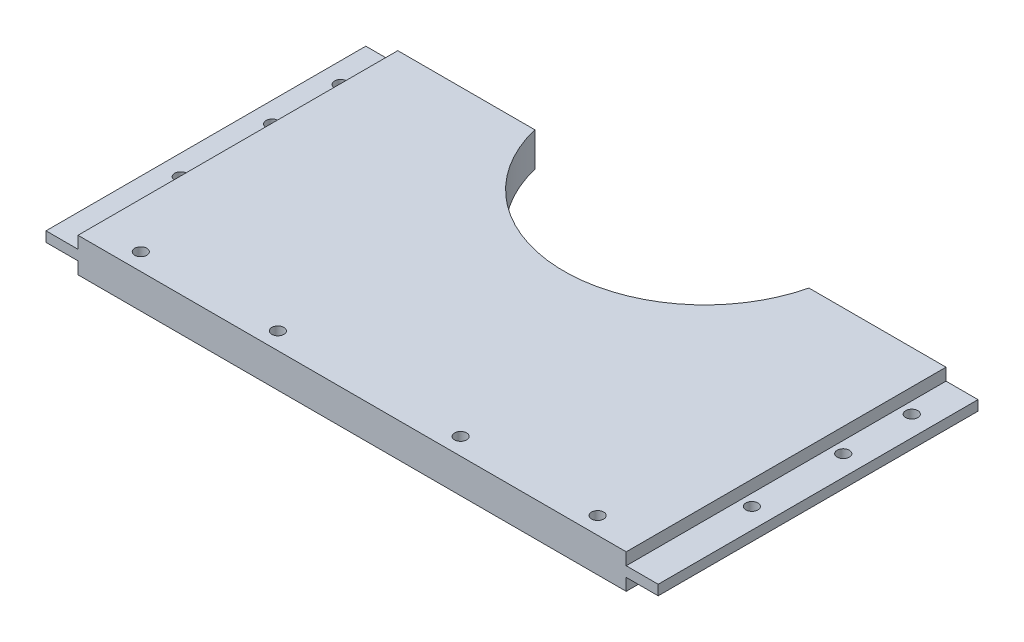
from build123d import *

# Parameters (mm, degrees)
BOSS_EXTRUDE1_DEPTH     = 9.525
SKETCH2_W               = 17.78
SKETCH2_H               = 177.8
BOSS_EXTRUDE2_DEPTH     = 2.794
F_1_4_CLEARANCE_HOLE1_D = 6.7564
F_1_4_CLEARANCE_HOLE2_D = 6.7564


with BuildPart() as part:
    # Sketch1 → Boss-Extrude1 (new, symmetric)
    with BuildSketch(Plane(origin=(0, 0, 0), x_dir=(1, 0, 0), z_dir=(0, 1, 0))):
        with BuildLine():
            Line((-76.2, 88.9), (-152.4, 88.9))
            Line((-152.4, 88.9), (-152.4, -88.9))
            Line((-152.4, -88.9), (152.4, -88.9))
            Line((152.4, -88.9), (152.4, 88.9))
            Line((152.4, 88.9), (76.2, 88.9))
            ThreePointArc((76.2, 88.9), (0, 28.883239197), (-76.2, 88.9))
        make_face()
    extrude(amount=BOSS_EXTRUDE1_DEPTH, both=True)

    # Sketch2 → Boss-Extrude2 (add, symmetric)
    with BuildSketch(Plane(origin=(0, 0, 0), x_dir=(1, 0, 0), z_dir=(0, 1, 0))):
        with Locations((-161.29, 0)):
            Rectangle(SKETCH2_W, SKETCH2_H)
        with Locations((161.29, 0)):
            Rectangle(SKETCH2_W, SKETCH2_H)
    extrude(amount=BOSS_EXTRUDE2_DEPTH, both=True)

    # 1/4 Clearance Hole1 (through all)
    with Locations(Plane(origin=(0, 2.794, 0), x_dir=(1, 0, 0), z_dir=(0, 1, 0))):
        with Locations((158.75, 63.5), (158.75, 25.4), (158.75, -25.4)):
            f_1_4_clearance_hole1 = Hole(F_1_4_CLEARANCE_HOLE1_D / 2)

    # Mirror1: 1/4 Clearance Hole1 across plane
    add(f_1_4_clearance_hole1.mirror(Plane(origin=(0, 0, 0), x_dir=(0, 0, 1), z_dir=(1, 0, 0))), mode=Mode.SUBTRACT)

    # 1/4 Clearance Hole2 (through all)
    with Locations(Plane(origin=(0, 9.525, 0), x_dir=(1, 0, 0), z_dir=(0, 1, 0))):
        with Locations((-127, -79.375), (-50.8, -79.375)):
            f_1_4_clearance_hole2 = Hole(F_1_4_CLEARANCE_HOLE2_D / 2)

    # Mirror2: 1/4 Clearance Hole2 across plane
    add(f_1_4_clearance_hole2.mirror(Plane(origin=(0, 0, 0), x_dir=(0, 0, 1), z_dir=(1, 0, 0))), mode=Mode.SUBTRACT)


solid = part.part
